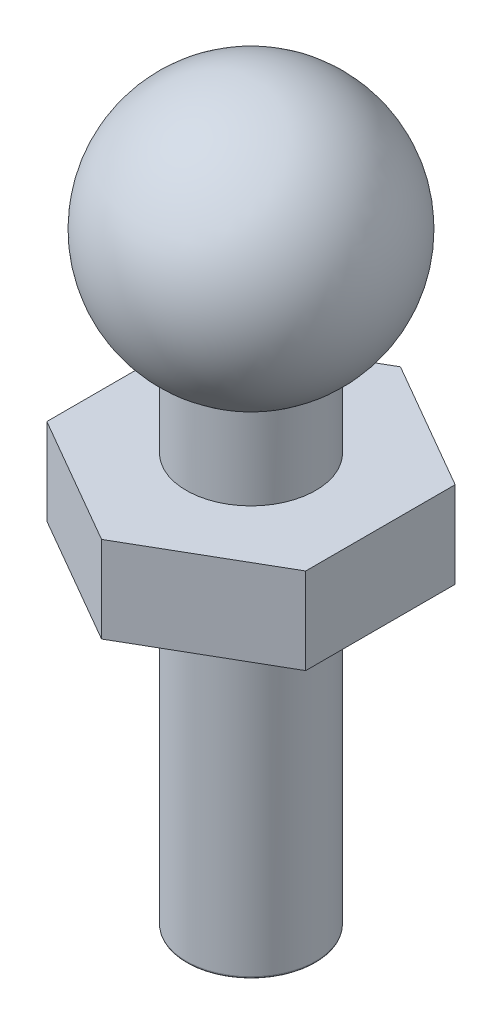
from build123d import *

# Parameters (mm, degrees)
FILLET1_R           = 0.05
SKETCH3_R           = 1.491662181
BOSS_EXTRUDE1_DEPTH = 2


with BuildPart() as part:
    # Sketch1 → Revolve1 (revolve)
    with BuildSketch(Plane.XY):
        with BuildLine():
            Line((0, 11), (0, 0))
            Line((0, 0), (1.5, 0))
            Line((1.5, 0), (1.5, 11.401923789))
            ThreePointArc((1.5, 11.401923789), (2.897777479, 14.776457135), (0, 17))
            Line((0, 17), (0, 11))
        make_face()
    revolve(axis=Axis((0, 11, 0), (0, -1, 0)))

    # Fillet1
    fillet1_edges = [part.edges().sort_by_distance(p)[0] for p in [
        (-1.5, 0, 0),
    ]]
    fillet(fillet1_edges, radius=FILLET1_R)

    # Sketch3 → Boss-Extrude1 (add)
    with BuildSketch(Plane(origin=(0, 7.5, 0), x_dir=(-1, 0, 0), z_dir=(0, -1, 0))):
        Polygon((0, 3.464101615), (-3, 1.732050808), (-3, -1.732050808), (0, -3.464101615), (3, -1.732050808), (3, 1.732050808), align=None)
        Circle(SKETCH3_R, mode=Mode.SUBTRACT)
    extrude(amount=-BOSS_EXTRUDE1_DEPTH)


solid = part.part
